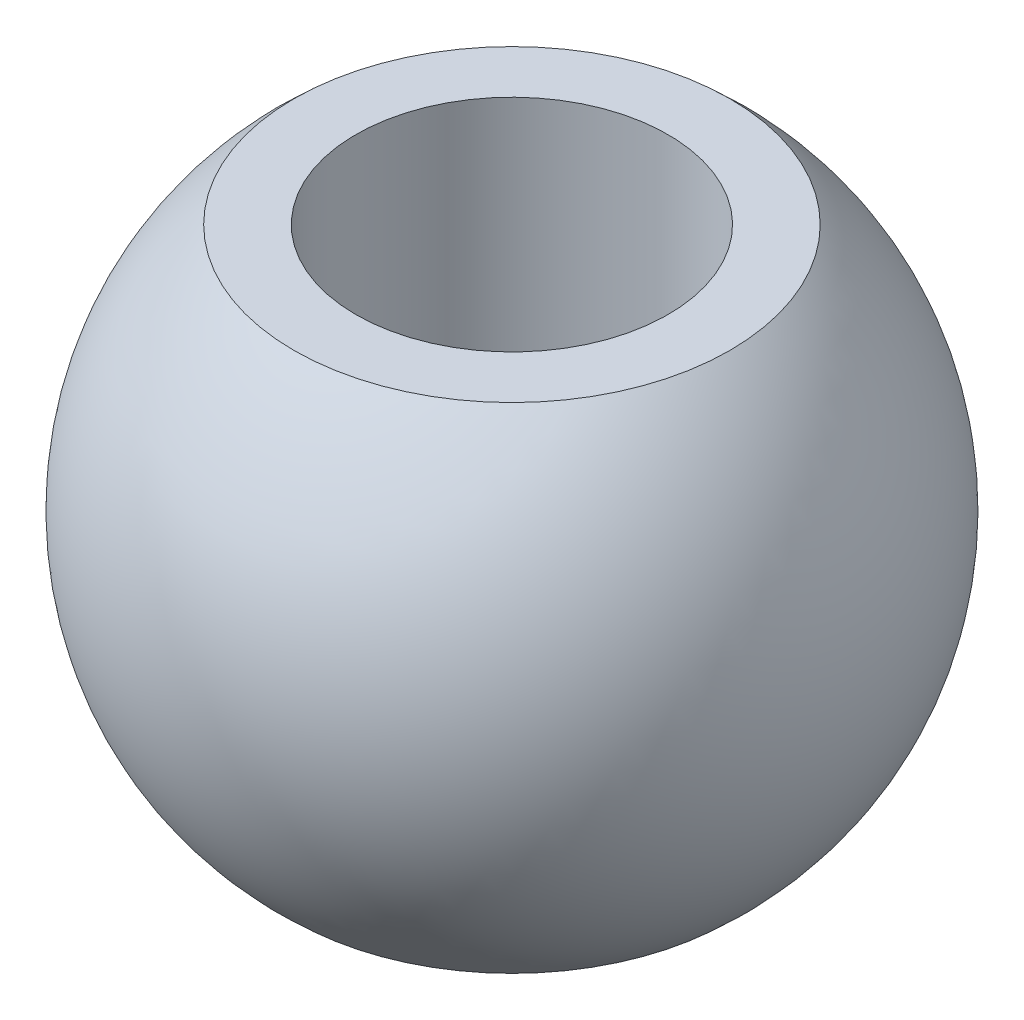
from build123d import *

# Parameters (mm, degrees)
SKETCH2_R      = 2.3876
EXTRUDE1_DEPTH = 6.3721
SKETCH3_R      = 1.1303
EXTRUDE2_DEPTH = 5.922163496


with BuildPart() as part:
    # Sketch1 → Revolve1 (revolve)
    with BuildSketch(Plane.XY):
        with BuildLine():
            Line((0, 2.3876), (0, -2.3876))
            ThreePointArc((0, -2.3876), (2.3876, 0), (0, 2.3876))
        make_face()
    revolve(axis=Axis((0, 2.3876, 0), (0, -1, 0)))

    # Sketch2 → Extrude1 (cut, through all)
    with BuildSketch(Plane(origin=(0, 1.7907, 0), x_dir=(-1, 0, 0), z_dir=(0, 1, 0))):
        Circle(SKETCH2_R)
    extrude1 = extrude(amount=EXTRUDE1_DEPTH, mode=Mode.SUBTRACT)

    # Mirror1: Extrude1 across plane
    add(extrude1.mirror(Plane.ZX), mode=Mode.SUBTRACT)

    # Sketch3 → Extrude2 (cut, through all)
    with BuildSketch(Plane(origin=(0, 1.7907, 0), x_dir=(-1, 0, 0), z_dir=(0, 1, 0))):
        with Locations(Location((0, 0, 0), (0, 0, 90))):
            Circle(SKETCH3_R)
    extrude(amount=-EXTRUDE2_DEPTH, mode=Mode.SUBTRACT)


solid = part.part
